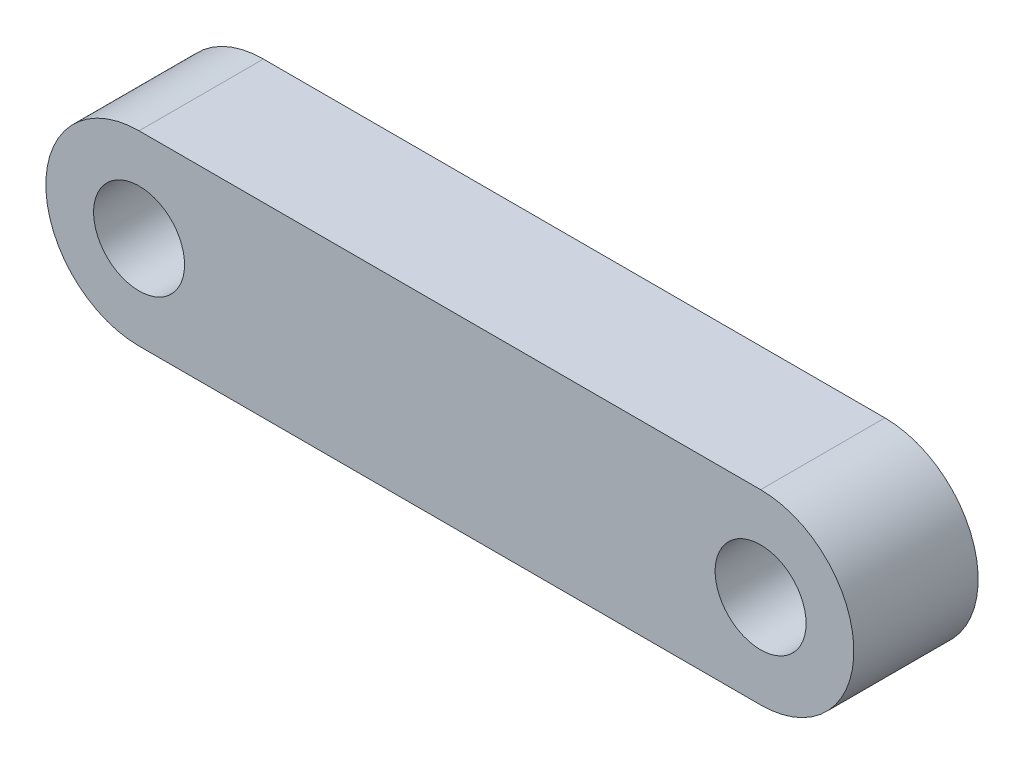
from build123d import *

# Parameters (mm, degrees)
SKETCH1_R           = 3.6576
BOSS_EXTRUDE1_DEPTH = 10


with BuildPart() as part:
    # Sketch1 → Boss-Extrude1 (new body)
    with BuildSketch(Plane.XY):
        with BuildLine():
            Line((0, 7.5), (50, 7.5))
            ThreePointArc((50, 7.5), (57.5, 0), (50, -7.5))
            Line((50, -7.5), (0, -7.5))
            ThreePointArc((0, -7.5), (-7.5, 0), (0, 7.5))
        make_face()
        Circle(SKETCH1_R, mode=Mode.SUBTRACT)
        with Locations((50, 0)):
            Circle(SKETCH1_R, mode=Mode.SUBTRACT)
    extrude(amount=BOSS_EXTRUDE1_DEPTH)


solid = part.part
